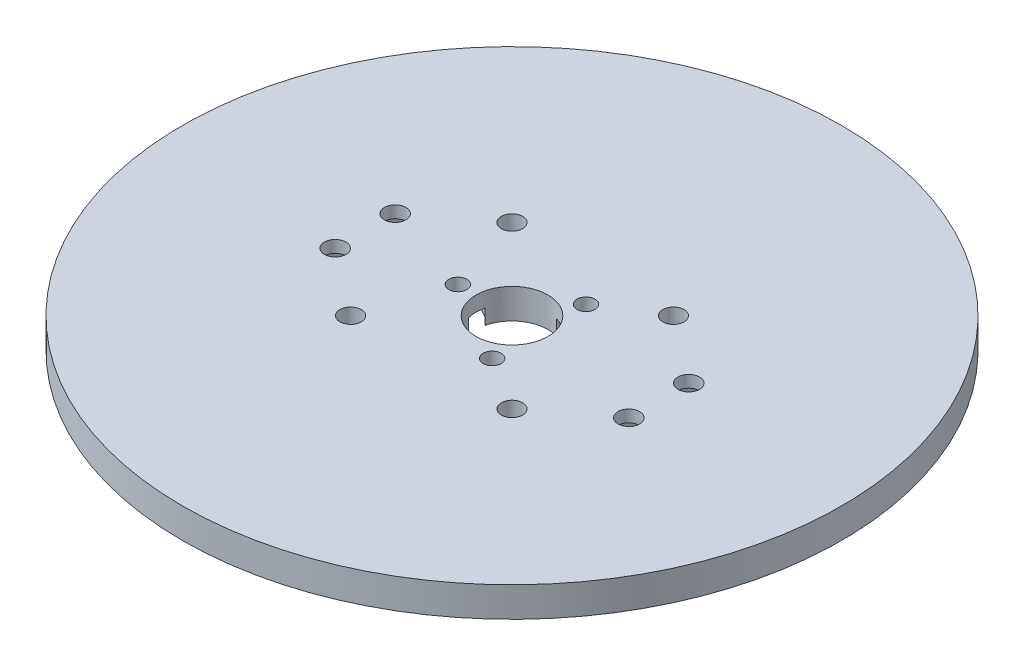
from build123d import *

# Parameters (mm, degrees)
SKETCH1_R           = 55
BOSS_EXTRUDE1_DEPTH = 5
SKETCH2_R           = 6
SKETCH2_R_2         = 1.78
CUT_EXTRUDE1_DEPTH  = 5
SKETCH3_R           = 1.5
CUT_EXTRUDE2_DEPTH  = 5
CUT_EXTRUDE5_DEPTH  = 2.5
SKETCH6_R           = 1.8
CUT_EXTRUDE6_DEPTH  = 10
CUT_EXTRUDE7_DEPTH  = 3


with BuildPart() as part:
    # Sketch1 → Boss-Extrude1 (new body)
    with BuildSketch(Plane(origin=(0, 0, 0), x_dir=(1, 0, 0), z_dir=(0, 1, 0))):
        with Locations(Location((0, 0, 0), (0, 0, 270))):
            Circle(SKETCH1_R)
    extrude(amount=BOSS_EXTRUDE1_DEPTH)

    # Sketch2 → Cut-Extrude1 (cut)
    with BuildSketch(Plane(origin=(0, 5, 0), x_dir=(1, 0, 0), z_dir=(0, 1, 0))):
        with Locations(Location((0, 0, 0), (0, 0, 270))):
            Circle(SKETCH2_R)
        with Locations(Location((-13.47, -13.47, 0), (0, 0, 270))):
            Circle(SKETCH2_R_2)
        with Locations(Location((-13.47, 13.47, 0), (0, 0, 270))):
            Circle(SKETCH2_R_2)
        with Locations(Location((13.47, 13.47, 0), (0, 0, 270))):
            Circle(SKETCH2_R_2)
        with Locations(Location((13.47, -13.47, 0), (0, 0, 270))):
            Circle(SKETCH2_R_2)
    extrude(amount=-CUT_EXTRUDE1_DEPTH, mode=Mode.SUBTRACT)

    # Sketch3 → Cut-Extrude2 (cut)
    with BuildSketch(Plane(origin=(0, 5, 0), x_dir=(1, 0, 0), z_dir=(0, 1, 0))):
        with Locations(Location((4.5175, -7.824539523, 0), (0, 0, 270))):
            Circle(SKETCH3_R)
        with Locations(Location((-9.035, 0, 0), (0, 0, 270))):
            Circle(SKETCH3_R)
        with Locations(Location((4.5175, 7.824539523, 0), (0, 0, 270))):
            Circle(SKETCH3_R)
    extrude(amount=-CUT_EXTRUDE2_DEPTH, mode=Mode.SUBTRACT)

    # Sketch5 → Cut-Extrude5 (cut)
    with BuildSketch(Plane.XZ):
        Polygon((4.475281589, -11.519340051), (7.696181913, -9.708502003), (7.738400324, -6.013701476), (4.559718411, -4.129738996), (1.338818087, -5.940577043), (1.296599676, -9.635377571), align=None)
        Polygon((7.738400324, 9.635377571), (4.559718411, 11.519340051), (1.338818087, 9.708502003), (1.296599676, 6.013701476), (4.475281589, 4.129738996), (7.696181913, 5.940577043), align=None)
        Polygon((-12.213681913, 1.88396248), (-12.255900324, -1.810838048), (-9.077218411, -3.694800528), (-5.856318087, -1.88396248), (-5.814099676, 1.810838048), (-8.992781589, 3.694800528), align=None)
    extrude(amount=-CUT_EXTRUDE5_DEPTH, mode=Mode.SUBTRACT)

    # Sketch6 → Cut-Extrude6 (cut)
    with BuildSketch(Plane(origin=(0, 5, 0), x_dir=(1, 0, 0), z_dir=(0, 1, 0))):
        with Locations(Location((24.5, -5, 0), (0, 0, 270))):
            Circle(SKETCH6_R)
        with Locations(Location((-24.5, -5, 0), (0, 0, 270))):
            Circle(SKETCH6_R)
        with Locations(Location((-24.5, 5, 0), (0, 0, 270))):
            Circle(SKETCH6_R)
        with Locations(Location((24.5, 5, 0), (0, 0, 270))):
            Circle(SKETCH6_R)
    extrude(amount=-CUT_EXTRUDE6_DEPTH, mode=Mode.SUBTRACT)

    # Sketch7 → Cut-Extrude7 (cut)
    with BuildSketch(Plane(origin=(0, 0, 0), x_dir=(-1, 0, 0), z_dir=(0, -1, 0))):
        Polygon((26.809401077, -1), (22.190598923, -1), (19.881197846, -5), (22.190598923, -9), (26.809401077, -9), (29.118802154, -5), align=None)
        Polygon((-29.118802154, -5), (-26.809401077, -9), (-22.190598923, -9), (-19.881197846, -5), (-22.190598923, -1), (-26.809401077, -1), align=None)
        Polygon((26.809401077, 9), (22.190598923, 9), (19.881197846, 5), (22.190598923, 1), (26.809401077, 1), (29.118802154, 5), align=None)
        Polygon((-22.190598923, 9), (-26.809401077, 9), (-29.118802154, 5), (-26.809401077, 1), (-22.190598923, 1), (-19.881197846, 5), align=None)
    extrude(amount=-CUT_EXTRUDE7_DEPTH, mode=Mode.SUBTRACT)


solid = part.part
